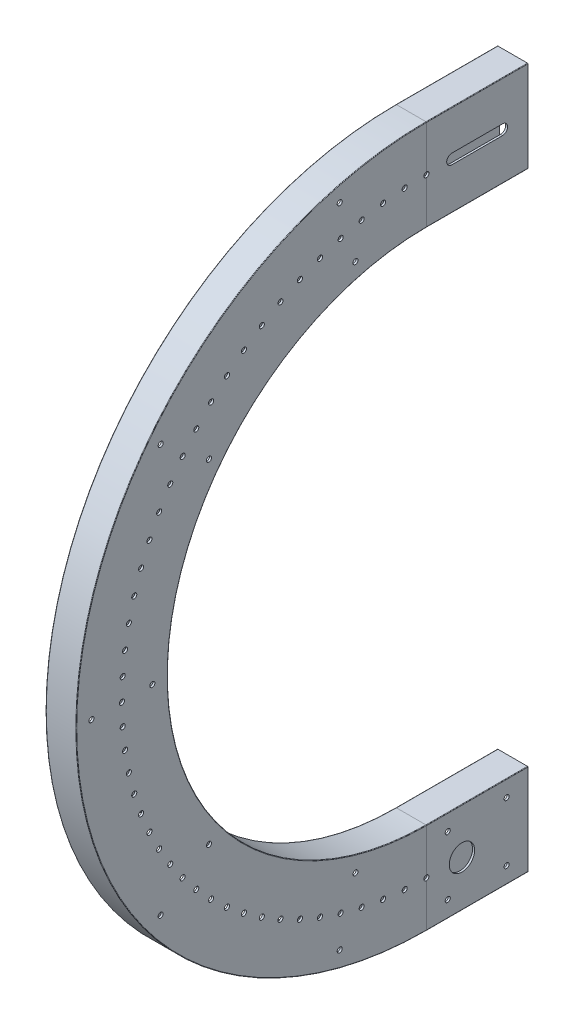
from build123d import *

# Parameters (mm, degrees)
SKETCH5_R          = 2.5
SKETCH5_R_2        = 12.5
CUT_EXTRUDE1_DEPTH = 10
SKETCH6_R          = 2.5
CUT_EXTRUDE2_DEPTH = 30
CIRPATTERN1_COUNT  = 5
CIRPATTERN1_ANGLE  = 150
CUT_EXTRUDE3_DEPTH = 2
SKETCH8_R          = 2.5
CUT_EXTRUDE4_DEPTH = 10
CIRPATTERN2_COUNT  = 45
CIRPATTERN2_ANGLE  = 180


with BuildPart() as part:
    # Sweep2: sweep along a path in Sketch4
    with BuildLine(Plane(origin=(0, 0, 0), x_dir=(0, 0, -1), z_dir=(1, 0, 0))) as sweep2_path:
        Line((0, 0), (-100, 0))
        ThreePointArc((-100, 0), (-400, 300), (-100, 600))
        Line((-100, 600), (0, 600))
    # Sketch2 → Sweep2 (sweep)
    with BuildSketch(Plane.XY):
        with BuildLine():
            Line((0, -44.5), (0, 44.5))
            ThreePointArc((0, 44.5), (-0.146446609, 44.853553391), (-0.5, 45))
            Line((-0.5, 45), (-29.5, 45))
            ThreePointArc((-29.5, 45), (-29.853553391, 44.853553391), (-30, 44.5))
            Line((-30, 44.5), (-30, 15))
            Line((-30, 15), (-28, 15))
            Line((-28, 15), (-28, 43))
            Line((-28, 43), (-2, 43))
            Line((-2, 43), (-2, -43))
            Line((-2, -43), (-28, -43))
            Line((-28, -43), (-28, -15))
            Line((-28, -15), (-30, -15))
            Line((-30, -15), (-30, -44.5))
            ThreePointArc((-30, -44.5), (-29.853553391, -44.853553391), (-29.5, -45))
            Line((-29.5, -45), (-0.5, -45))
            ThreePointArc((-0.5, -45), (-0.146446609, -44.853553391), (0, -44.5))
        make_face()
    sweep(path=sweep2_path.line)

    # Sketch5 → Cut-Extrude1 (cut)
    with BuildSketch(Plane(origin=(0, 0, 0), x_dir=(0, 0, -1), z_dir=(1, 0, 0))):
        with Locations((-78.991378029, 28.991378029)):
            Circle(SKETCH5_R)
        with Locations((-78.991378029, -28.991378029)):
            Circle(SKETCH5_R)
        with Locations((-21.008621971, 28.991378029)):
            Circle(SKETCH5_R)
        with Locations((-21.008621971, -28.991378029)):
            Circle(SKETCH5_R)
        with Locations((-65, 0)):
            Circle(SKETCH5_R_2)
    extrude(amount=-CUT_EXTRUDE1_DEPTH, mode=Mode.SUBTRACT)

    # Sketch6 → Cut-Extrude2 (cut)
    with BuildSketch(Plane.ZY.offset(30)):
        with Locations((169.881142178, 39.200026902)):
            Circle(SKETCH6_R)
        with Locations((185.410284884, -18.755522675)):
            Circle(SKETCH6_R)
    cut_extrude2 = extrude(amount=-CUT_EXTRUDE2_DEPTH, mode=Mode.SUBTRACT)

    # CirPattern1: Cut-Extrude2 ×5 about axis
    cirpattern1_axis = Axis((0, 300, 100), (-1, 0, 0))
    for i in range(1, CIRPATTERN1_COUNT):
        add(cut_extrude2.rotate(cirpattern1_axis, i * CIRPATTERN1_ANGLE / (CIRPATTERN1_COUNT - 1)), mode=Mode.SUBTRACT)

    # Sketch7 → Cut-Extrude3 (cut)
    with BuildSketch(Plane.ZY.offset(2)):
        with BuildLine():
            Line((75, 595.885896699), (25, 595.885896699))
            ThreePointArc((25, 595.885896699), (20, 600.885896699), (25, 605.885896699))
            Line((25, 605.885896699), (75, 605.885896699))
            ThreePointArc((75, 605.885896699), (80, 600.885896699), (75, 595.885896699))
        make_face()
    extrude(amount=-CUT_EXTRUDE3_DEPTH, mode=Mode.SUBTRACT)

    # Sketch8 → Cut-Extrude4 (cut)
    with BuildSketch(Plane.ZY.offset(2)):
        with Locations(Location((100, 0, 0), (0, 0, 90))):
            Circle(SKETCH8_R)
    cut_extrude4 = extrude(amount=-CUT_EXTRUDE4_DEPTH, mode=Mode.SUBTRACT)

    # CirPattern2: Cut-Extrude4 ×45 about axis
    cirpattern2_axis = Axis((0, 300, 100), (-1, 0, 0))
    for i in range(1, CIRPATTERN2_COUNT):
        add(cut_extrude4.rotate(cirpattern2_axis, i * CIRPATTERN2_ANGLE / (CIRPATTERN2_COUNT - 1)), mode=Mode.SUBTRACT)


solid = part.part
